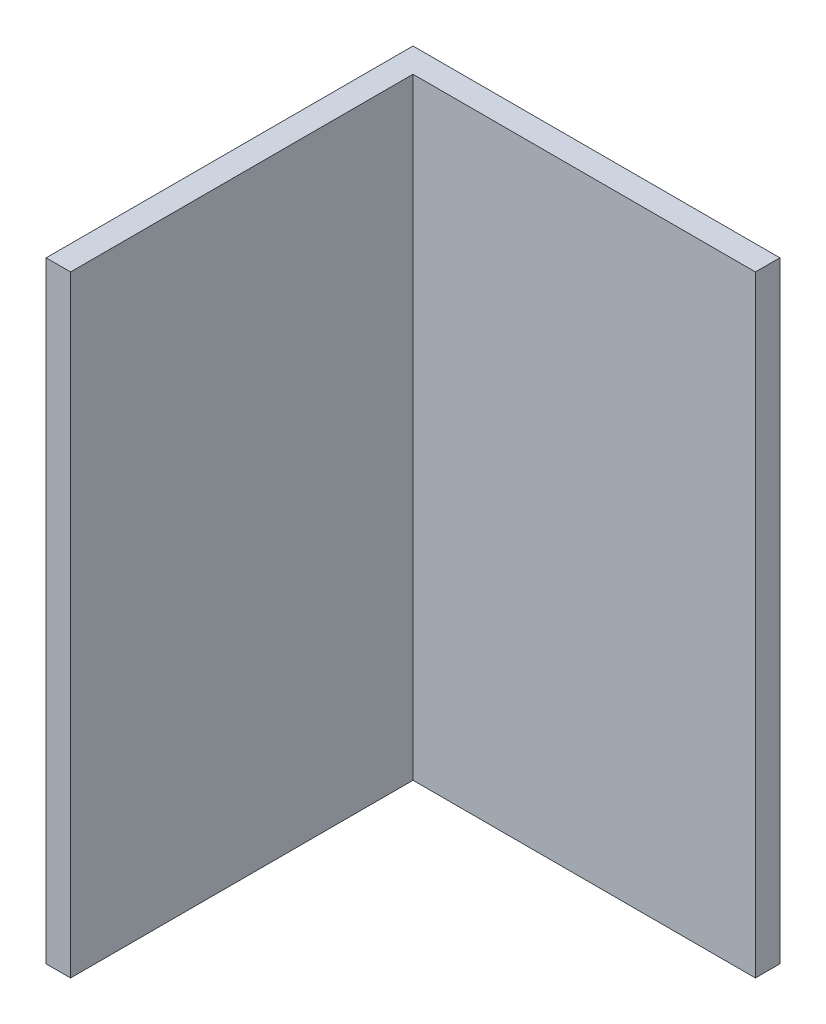
from build123d import *

# Parameters (mm, degrees)
ESQUISSE1_W        = 30
ESQUISSE1_H        = 50
BOSS_EXTRU_1_DEPTH = 2
ESQUISSE2_W        = 2
ESQUISSE2_H        = 50
BOSS_EXTRU_2_DEPTH = 28


with BuildPart() as part:
    # Esquisse1 → Boss.-Extru.1 (new body)
    with BuildSketch(Plane.XY):
        with Locations((15, 25)):
            Rectangle(ESQUISSE1_W, ESQUISSE1_H)
    extrude(amount=BOSS_EXTRU_1_DEPTH)

    # Esquisse2 → Boss.-Extru.2 (add)
    with BuildSketch(Plane.XY.offset(2)):
        with Locations((1, 25)):
            Rectangle(ESQUISSE2_W, ESQUISSE2_H)
    extrude(amount=BOSS_EXTRU_2_DEPTH)


solid = part.part
